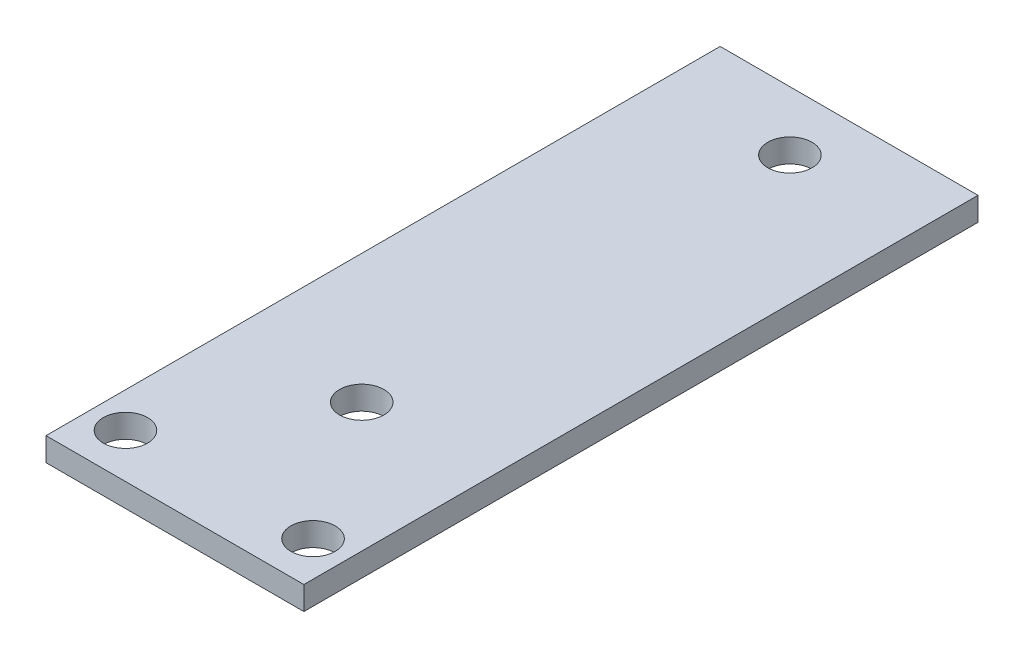
from build123d import *

# Parameters (mm, degrees)
SKETCH1_W           = 38.1
SKETCH1_H           = 120
BOSS_EXTRUDE1_DEPTH = 38.1
SKETCH2_W           = 34.925
SKETCH2_H           = 34.925
CUT_EXTRUDE1_DEPTH  = 130.767142413
SKETCH18_W          = 3.175
SKETCH18_H          = 3.175
CUT_EXTRUDE3_DEPTH  = 130.767142413
SKETCH19_R          = 3
CUT_EXTRUDE4_DEPTH  = 121.228267267
SKETCH20_W          = 34.925
SKETCH20_H          = 5
CUT_EXTRUDE5_DEPTH  = 121.228267267
SKETCH21_W          = 34.925
SKETCH21_H          = 23.7
CUT_EXTRUDE6_DEPTH  = 121.228267267


with BuildPart() as part:
    # Sketch1 → Boss-Extrude1 (new body)
    with BuildSketch(Plane.XZ.offset(34.925)):
        with Locations((15.875, -55)):
            Rectangle(SKETCH1_W, SKETCH1_H)
    extrude(amount=-BOSS_EXTRUDE1_DEPTH)

    # Sketch2 → Cut-Extrude1 (cut, through all)
    with BuildSketch(Plane(origin=(0, 0, -115), x_dir=(-1, 0, 0), z_dir=(0, 0, -1))):
        with Locations((-17.4625, -17.4625)):
            Rectangle(SKETCH2_W, SKETCH2_H)
    extrude(amount=-CUT_EXTRUDE1_DEPTH, mode=Mode.SUBTRACT)

    # Sketch18 → Cut-Extrude3 (cut, through all)
    with BuildSketch(Plane.XY.offset(5)):
        with Locations((-1.5875, 1.5875)):
            Rectangle(SKETCH18_W, SKETCH18_H)
    extrude(amount=-CUT_EXTRUDE3_DEPTH, mode=Mode.SUBTRACT)


with BuildPart() as body_2:
    # of the pieces the cut leaves, the one that is kept (cut_extrude3_keep)
    add(part.part.solids().sort_by_distance((34.925, 0, -115))[0])

    # Sketch19 → Cut-Extrude4 (cut, through all)
    with BuildSketch(Plane.XZ):
        with Locations(Location((4.7625, -6, 0), (0, 0, 270))):
            Circle(SKETCH19_R)
        with Locations(Location((30.1625, -6, 0), (0, 0, 270))):
            Circle(SKETCH19_R)
        with Locations(Location((17.4625, -83.29, 0), (0, 0, 270))):
            Circle(SKETCH19_R)
        with Locations(Location((17.4625, -25.3, 0), (0, 0, 270))):
            Circle(SKETCH19_R)
    extrude(amount=-CUT_EXTRUDE4_DEPTH, mode=Mode.SUBTRACT)

    # Sketch20 → Cut-Extrude5 (cut, through all)
    with BuildSketch(Plane.XZ):
        with Locations((17.4625, 2.5)):
            Rectangle(SKETCH20_W, SKETCH20_H)
    extrude(amount=-CUT_EXTRUDE5_DEPTH, mode=Mode.SUBTRACT)

    # Sketch21 → Cut-Extrude6 (cut, through all)
    with BuildSketch(Plane.XZ):
        with Locations((17.4625, -103.15)):
            Rectangle(SKETCH21_W, SKETCH21_H)
    extrude(amount=-CUT_EXTRUDE6_DEPTH, mode=Mode.SUBTRACT)


solid = body_2.part
